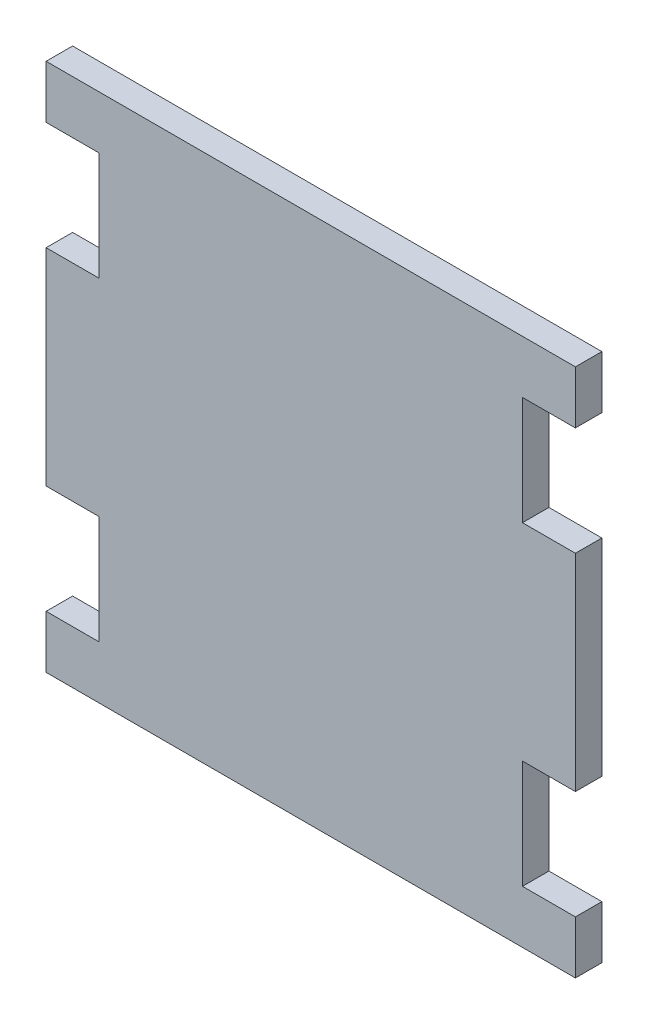
from build123d import *

# Parameters (mm, degrees)
ESQUISSE1_W             = 200
ESQUISSE1_H             = 200
BOSS_EXTRU_1_DEPTH      = 10
ESQUISSE2_W             = 20
ESQUISSE2_H             = 41
ENL_V_MAT_EXTRU_1_DEPTH = 10


with BuildPart() as part:
    # Esquisse1 → Boss.-Extru.1 (new body)
    with BuildSketch(Plane.XY):
        with Locations((100, -100)):
            Rectangle(ESQUISSE1_W, ESQUISSE1_H)
    extrude(amount=BOSS_EXTRU_1_DEPTH)

    # Esquisse2 → Enlèv. mat.-Extru.1 (cut)
    with BuildSketch(Plane.XY.offset(10)):
        with Locations((10, -40.5)):
            Rectangle(ESQUISSE2_W, ESQUISSE2_H)
        with Locations((10, -159.5)):
            Rectangle(ESQUISSE2_W, ESQUISSE2_H)
        with Locations((190, -40.5)):
            Rectangle(ESQUISSE2_W, ESQUISSE2_H)
        with Locations((190, -159.5)):
            Rectangle(ESQUISSE2_W, ESQUISSE2_H)
    extrude(amount=-ENL_V_MAT_EXTRU_1_DEPTH, mode=Mode.SUBTRACT)


solid = part.part
